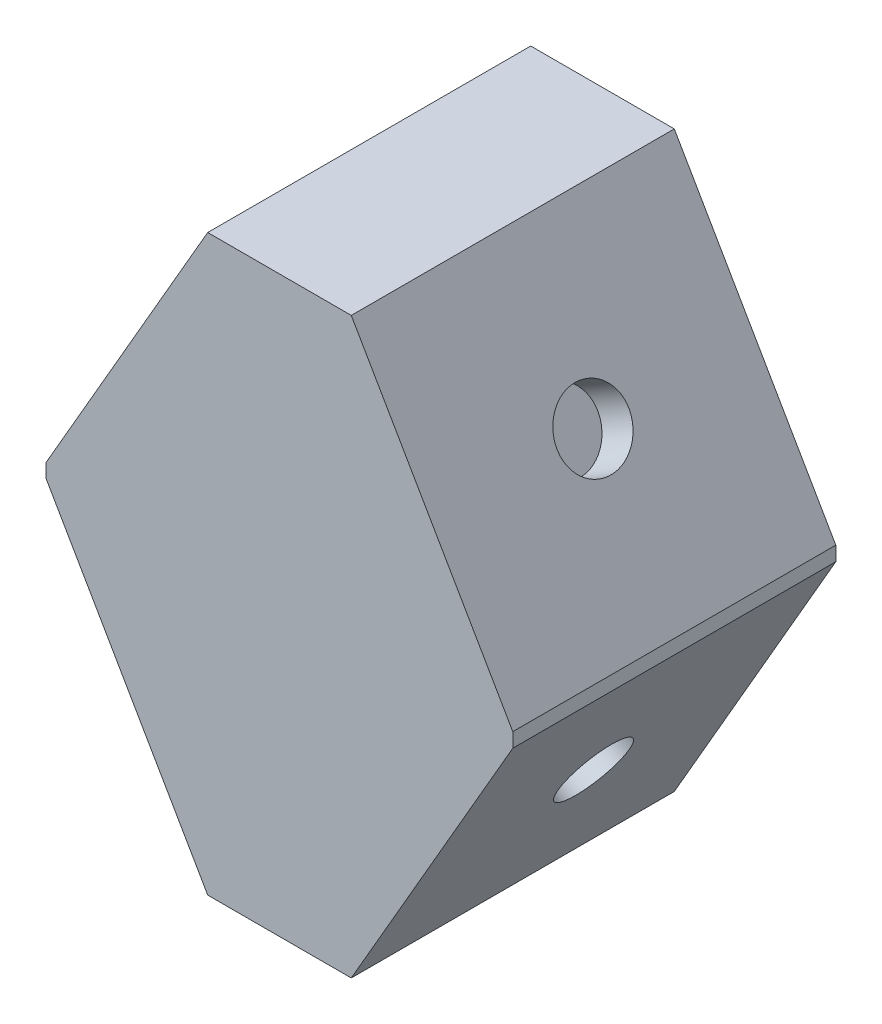
from build123d import *

# Parameters (mm, degrees)
BOSS_EXTRUDE1_DEPTH = 45
SKETCH3_R           = 5
CUT_EXTRUDE1_DEPTH  = 5
SKETCH4_R           = 5
CUT_EXTRUDE2_DEPTH  = 5
SKETCH5_R           = 5
CUT_EXTRUDE3_DEPTH  = 5
SKETCH6_R           = 5
CUT_EXTRUDE4_DEPTH  = 5


with BuildPart() as part:
    # Sketch2 → Boss-Extrude1 (new body)
    with BuildSketch(Plane.XY):
        Polygon((-10, 39.97114317), (10, 39.97114317), (32.5, 1), (32.5, -1), (10, -39.97114317), (-10, -39.97114317), (-32.5, -1), (-32.5, 1), align=None)
    extrude(amount=BOSS_EXTRUDE1_DEPTH)

    # Sketch3 → Cut-Extrude1 (cut)
    with BuildSketch(Plane(origin=(24.808012702, 14.322912811, 0), x_dir=(0, 0, -1), z_dir=(0.8660254037844365, 0.500000000000004, 0))):
        with Locations(Location((-22.5, 7.281943839, 0), (0, 0, 90))):
            Circle(SKETCH3_R)
    extrude(amount=-CUT_EXTRUDE1_DEPTH, mode=Mode.SUBTRACT)

    # Sketch4 → Cut-Extrude2 (cut)
    with BuildSketch(Plane(origin=(-24.808012702, 14.322912811, 0), x_dir=(0, 0, 1), z_dir=(-0.8660254037844253, 0.5000000000000234, 0))):
        with Locations(Location((22.5, 7.116025404, 0), (0, 0, 270))):
            Circle(SKETCH4_R)
    extrude(amount=-CUT_EXTRUDE2_DEPTH, mode=Mode.SUBTRACT)

    # Sketch5 → Cut-Extrude3 (cut)
    with BuildSketch(Plane(origin=(-24.808012702, -14.322912811, 0), x_dir=(0, 0, 1), z_dir=(-0.8660254037844344, -0.5000000000000075, 0))):
        with Locations(Location((22.5, -7.116025404, 0), (0, 0, 270))):
            Circle(SKETCH5_R)
    extrude(amount=-CUT_EXTRUDE3_DEPTH, mode=Mode.SUBTRACT)

    # Sketch6 → Cut-Extrude4 (cut)
    with BuildSketch(Plane(origin=(24.808012702, -14.322912811, 0), x_dir=(0, 0, -1), z_dir=(0.8660254037844365, -0.500000000000004, 0))):
        with Locations(Location((-22.5, -7.116025404, 0), (0, 0, 90))):
            Circle(SKETCH6_R)
    extrude(amount=-CUT_EXTRUDE4_DEPTH, mode=Mode.SUBTRACT)


solid = part.part
